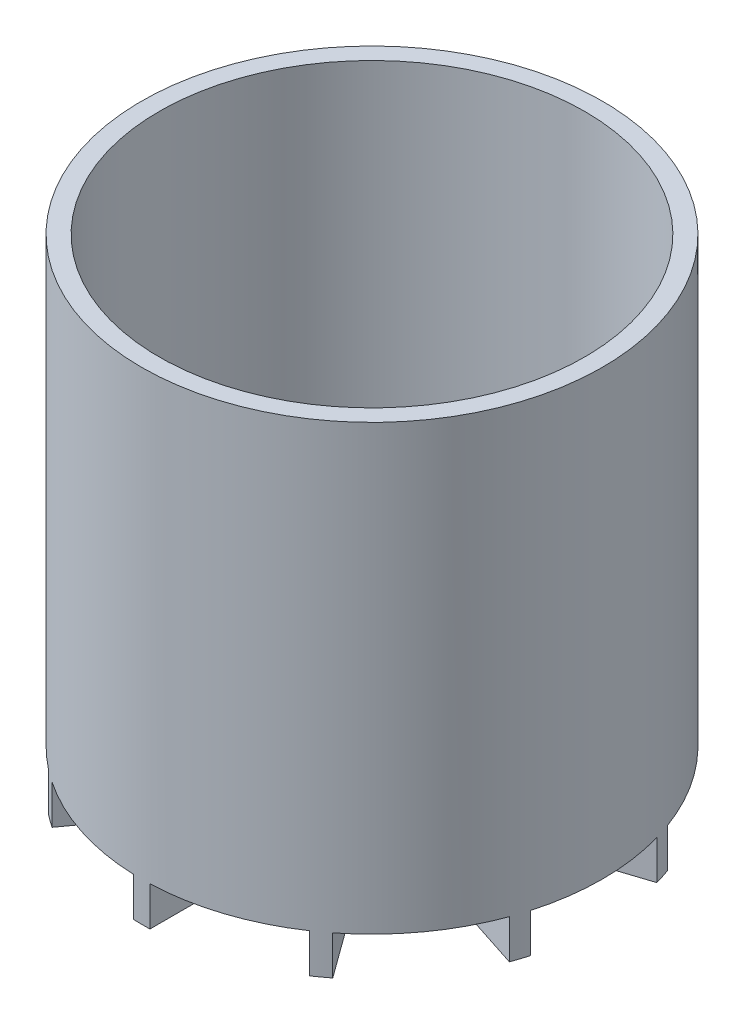
from build123d import *
from build123d.topology import SkipClean

# Parameters (mm, degrees)
SKETCH1_R               = 38.1
BOSS_EXTRUDE1_DEPTH     = 76.2
SHELL2_T                = 3.175
BOSS_EXTRUDE2_DEPTH     = 7
CUT_EXTRUDE1_DEPTH      = 99.527366122
CUT_EXTRUDE1_DEPTH_BACK = 99.527366122
SKETCH3_R               = 61.906276858
SKETCH3_R_2             = 41.275
SKETCH4_R               = 20.64
CUT_EXTRUDE2_DEPTH      = 7
SCALE1_SCALE            = 0.615384615


with BuildPart() as part:
    # Sketch1 → Boss-Extrude1 (new body)
    with BuildSketch(Plane(origin=(0, 0, 0), x_dir=(1, 0, 0), z_dir=(0, 1, 0))):
        with Locations(Location((0, 0, 0), (0, 0, 90))):
            Circle(SKETCH1_R)
    extrude(amount=BOSS_EXTRUDE1_DEPTH)

    # Shell2
    shell2_openings = [part.faces().sort_by_distance(p)[0] for p in [
        (0, 76.2, 0),
    ]]
    offset(amount=SHELL2_T, openings=shell2_openings, kind=Kind.INTERSECTION)

    # Sketch2 → Boss-Extrude2 (add)
    with BuildSketch(Plane(origin=(0, -3.175, 0), x_dir=(-1, 0, 0), z_dir=(0, -1, 0))):
        Polygon((-4.854101966, 0), (-39.718383202, -11.328091668), (-38.791332219, -14.181261217), (-3.927050983, -2.853169549), (-25.47436178, -32.510498564), (-23.047310797, -34.273854321), (-1.5, -4.616525306), (-1.5, -41.275), (1.5, -41.275), (1.5, -4.616525306), (23.047310797, -34.273854321), (25.47436178, -32.510498564), (3.927050983, -2.853169549), (38.791332219, -14.181261217), (39.718383202, -11.328091668), (4.854101966, 0), (39.718383202, 11.328091668), (38.791332219, 14.181261217), (3.927050983, 2.853169549), (25.47436178, 32.510498564), (23.047310797, 34.273854321), (1.5, 4.616525306), (1.5, 41.275), (-1.5, 41.275), (-1.5, 4.616525306), (-23.047310797, 34.273854321), (-25.47436178, 32.510498564), (-3.927050983, 2.853169549), (-38.791332219, 14.181261217), (-39.718383202, 11.328091668), align=None)
    extrude(amount=BOSS_EXTRUDE2_DEPTH)

    # Sketch3 → Cut-Extrude1 (cut, two sides: drawn at the far end of the back side and taken through both)
    with SkipClean():  # the faces are left unmerged after this step: merging them gives an invalid solid
        with BuildSketch(Plane.XZ.offset(3.175).offset(-CUT_EXTRUDE1_DEPTH_BACK)):
            Circle(SKETCH3_R)
            with Locations(Location((0, 0, 0), (0, 0, 272.082679548))):
                Circle(SKETCH3_R_2, mode=Mode.SUBTRACT)
        extrude(amount=CUT_EXTRUDE1_DEPTH + CUT_EXTRUDE1_DEPTH_BACK, mode=Mode.SUBTRACT)

    # Sketch4 → Cut-Extrude2 (cut)
    with SkipClean():  # the faces are left unmerged after this step: merging them gives an invalid solid
        with BuildSketch(Plane.XZ.offset(10.175)):
            Circle(SKETCH4_R)
        extrude(amount=-CUT_EXTRUDE2_DEPTH, mode=Mode.SUBTRACT)


with BuildPart() as part_1:
    # Scale1: scaled about (0, 27.463968189, 0)
    add(part.part.scale(SCALE1_SCALE).moved(Location((0, 10.563064688, 0))))


solid = part_1.part
